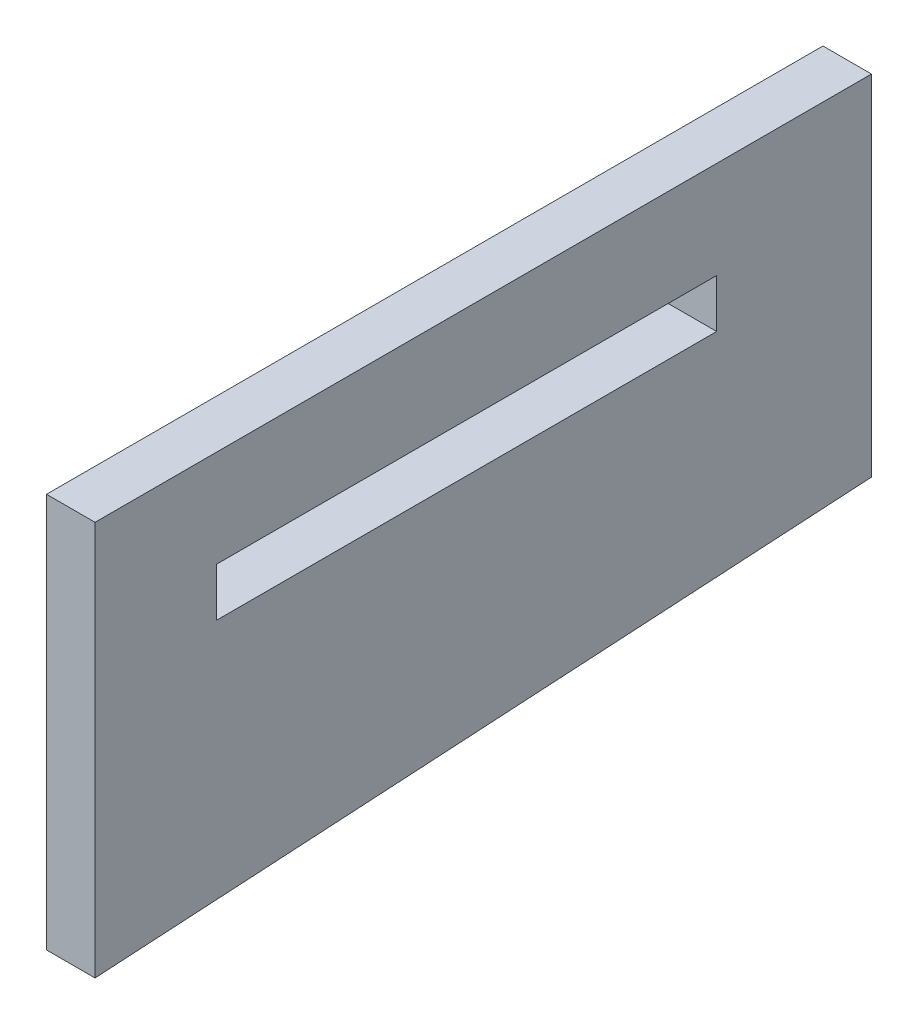
from build123d import *

# Parameters (mm, degrees)
SKETCH1_W           = 32.735153169
SKETCH1_H           = 3.175
BOSS_EXTRUDE1_DEPTH = 3.175


with BuildPart() as part:
    # Sketch1 → Boss-Extrude1 (new body)
    with BuildSketch(Plane(origin=(0, 0, 0), x_dir=(0, 0, -1), z_dir=(1, 0, 0))):
        Polygon((-40.672653169, 9.525), (10.127346831, 9.525), (10.127346831, -13.316680621), (-40.672653169, -16.296041968), align=None)
        with Locations((-16.367576585, 1.5875)):
            Rectangle(SKETCH1_W, SKETCH1_H, mode=Mode.SUBTRACT)
    extrude(amount=-BOSS_EXTRUDE1_DEPTH)


solid = part.part
